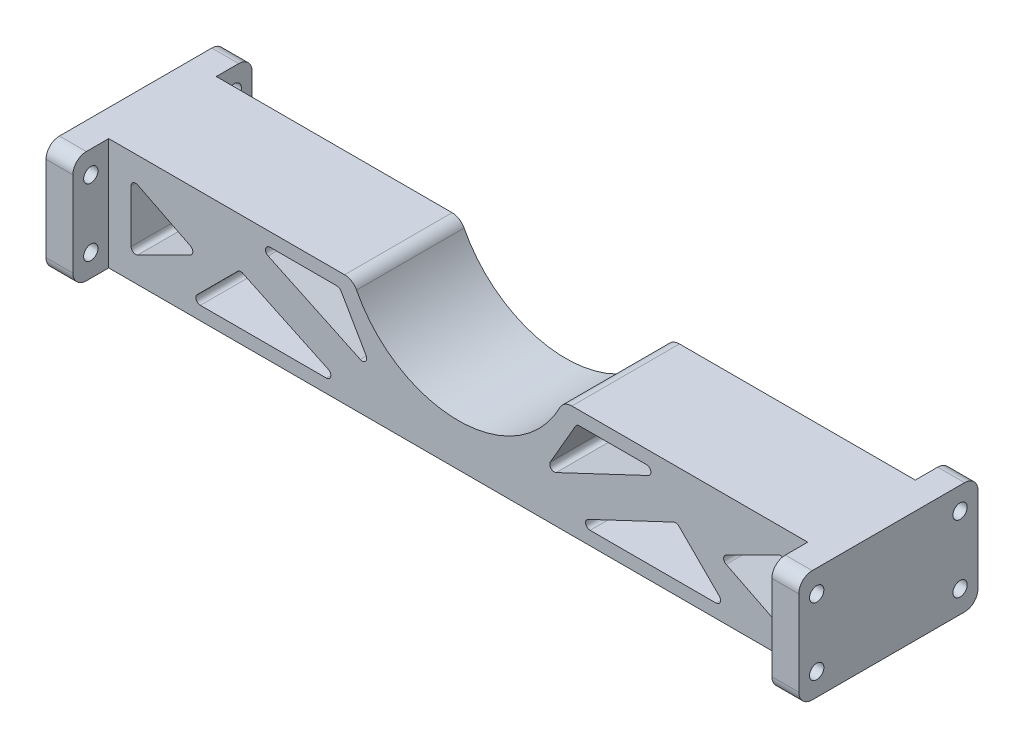
from build123d import *

# Parameters (mm, degrees)
SKETCH_1_W          = 168
SKETCH_1_H          = 25
EXTRUDE_1_DEPTH     = 40
SKETCH_2_R          = 25.5
CUT_EXTRUDE_1_DEPTH = 175.496418301
SKETCH_3_W          = 156
SKETCH_3_H          = 25
CUT_EXTRUDE_2_DEPTH = 8
CUT_EXTRUDE_3_DEPTH = 8
SKETCH_5_R          = 1.6
CUT_EXTRUDE_4_DEPTH = 175.496418301
CUT_EXTRUDE_5_DEPTH = 173.838074509
FILLET_2_R          = 1
FILLET_3_R          = 3
FILLET_4_R          = 3
FILLET_5_R          = 3


with BuildPart() as part:
    # 草图1 → 凸台-拉伸1 (new body)
    with BuildSketch(Plane.XY):
        with Locations((84, -12.5)):
            Rectangle(SKETCH_1_W, SKETCH_1_H)
    extrude(amount=EXTRUDE_1_DEPTH)

    # 草图2 → 切除-拉伸1 (cut, through all)
    with BuildSketch(Plane.XY.offset(40)):
        with Locations((84, 10)):
            Circle(SKETCH_2_R)
    extrude(amount=-CUT_EXTRUDE_1_DEPTH, mode=Mode.SUBTRACT)

    # 草图3 → 切除-拉伸2 (cut)
    with BuildSketch(Plane(origin=(0, 0, 0), x_dir=(-1, 0, 0), z_dir=(0, 0, -1))):
        with Locations((-84, -12.5)):
            Rectangle(SKETCH_3_W, SKETCH_3_H)
    extrude(amount=-CUT_EXTRUDE_2_DEPTH, mode=Mode.SUBTRACT)

    # 草图4 → 切除-拉伸3 (cut)
    with BuildSketch(Plane.XY.offset(40)):
        with BuildLine():
            Line((162, 0), (107.457408211, 0))
            ThreePointArc((107.457408211, 0), (84, -15.5), (60.542591789, 0))
            Line((60.542591789, 0), (6, 0))
            Line((6, 0), (6, -25))
            Line((6, -25), (162, -25))
            Line((162, -25), (162, 0))
        make_face()
    extrude(amount=-CUT_EXTRUDE_3_DEPTH, mode=Mode.SUBTRACT)

    # 草图5 → 切除-拉伸4 (cut, through all)
    with BuildSketch(Plane.ZY):
        with Locations((4, -5)):
            Circle(SKETCH_5_R)
        with Locations((4, -20)):
            Circle(SKETCH_5_R)
        with Locations((36, -20)):
            Circle(SKETCH_5_R)
        with Locations((36, -5)):
            Circle(SKETCH_5_R)
    extrude(amount=-CUT_EXTRUDE_4_DEPTH, mode=Mode.SUBTRACT)

    # 草图7 → 切除-拉伸5 (cut, through all)
    with BuildSketch(Plane.XY.offset(32)):
        Polygon((37.542591789, -3), (57.542591789, -3), (65.042591789, -15.990381057), align=None)
        Polygon((24.034609426, -22), (59.034609426, -22), (35.263531583, -10.771077843), align=None)
        Polygon((11, -5), (11, -20), (26, -12.5), align=None)
        Polygon((157, -5), (157, -20), (142, -12.5), align=None)
        Polygon((132.736468417, -10.771077843), (143.965390574, -22), (108.965390574, -22), align=None)
        Polygon((110.457408211, -3), (102.957408211, -15.990381057), (130.457408211, -3), align=None)
    extrude(amount=-CUT_EXTRUDE_5_DEPTH, mode=Mode.SUBTRACT)

    # 圆角2
    fillet_2_edges = [part.edges().sort_by_distance(p)[0] for p in [
        (37.542591789, -3, 20),
        (57.542591789, -3, 20),
        (130.457408211, -3, 20),
        (102.957408211, -15.990381057, 20),
        (110.457408211, -3, 20),
        (157, -5, 20),
        (157, -20, 20),
        (142, -12.5, 20),
        (132.736468417, -10.771077843, 20),
        (143.965390574, -22, 20),
        (108.965390574, -22, 20),
        (35.263531583, -10.771077843, 20),
        (59.034609426, -22, 20),
        (24.034609426, -22, 20),
        (26, -12.5, 20),
        (11, -20, 20),
        (11, -5, 20),
        (65.042591789, -15.990381057, 20),
    ]]
    fillet(fillet_2_edges, radius=FILLET_2_R)

    # 圆角3
    fillet_3_edges = [part.edges().sort_by_distance(p)[0] for p in [
        (107.457408211, 0, 20),
        (60.542591789, 0, 20),
    ]]
    fillet(fillet_3_edges, radius=FILLET_3_R)

    # 圆角4
    fillet_4_edges = [part.edges().sort_by_distance(p)[0] for p in [
        (3, 0, 0),
        (3, -25, 40),
        (3, -25, 0),
        (3, 0, 40),
    ]]
    fillet(fillet_4_edges, radius=FILLET_4_R)

    # 圆角5
    fillet_5_edges = [part.edges().sort_by_distance(p)[0] for p in [
        (165, -25, 0),
        (165, -25, 40),
        (165, 0, 0),
        (165, 0, 40),
    ]]
    fillet(fillet_5_edges, radius=FILLET_5_R)


solid = part.part
